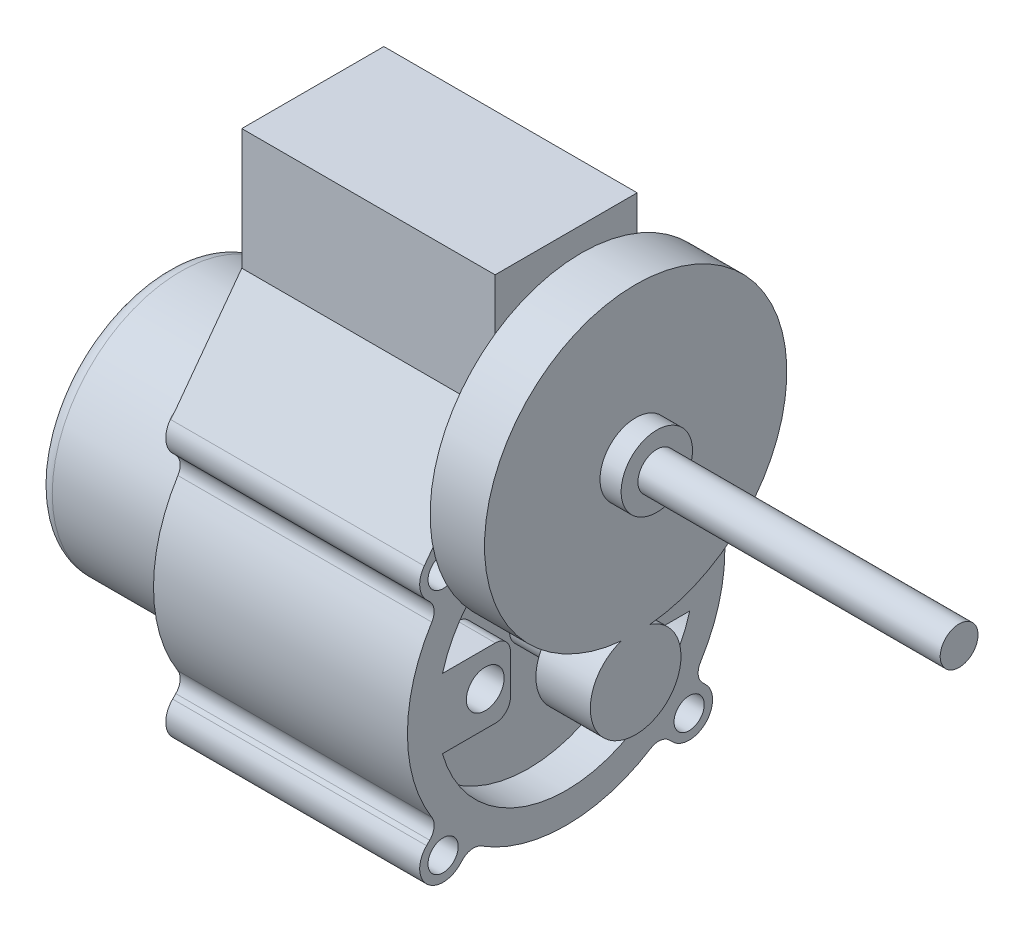
from build123d import *

# Parameters (mm, degrees)
SKETCH1_R                = 13.335
SKETCH1_R_2              = 10.795
BOSS_EXTRUDE1_DEPTH      = 21.336
SKETCH2_R                = 1.27
BOSS_EXTRUDE2_DEPTH      = 21.336
FILLET1_R                = 1.27
CIRPATTERN1_COUNT        = 4
FILLET1_OF_CIRPATTERN1_R = 1.27
SKETCH3_R                = 1.5875
BOSS_EXTRUDE3_DEPTH      = 3.175
FILLET2_R                = 1.27
SKETCH4_R                = 10.795
BOSS_EXTRUDE4_DEPTH      = 30.48
FILLET3_R                = 1.27
BOSS_EXTRUDE5_DEPTH      = 21.2852
SKETCH6_R                = 1.5875
BOSS_EXTRUDE6_DEPTH      = 6.985
SKETCH7_R                = 4.064
BOSS_EXTRUDE7_DEPTH      = 1.27
SKETCH8_R                = 12.7
SKETCH8_R_2              = 4.064
SKETCH8_R_3              = 3.81
BOSS_EXTRUDE10_DEPTH     = 4.572
SKETCH9_R                = 2.9972
BOSS_EXTRUDE12_DEPTH     = 1.778
SKETCH10_R               = 1.5875
BOSS_EXTRUDE13_DEPTH     = 25.4


with BuildPart() as part:
    # Sketch1 → Boss-Extrude1 (new body)
    with BuildSketch(Plane(origin=(0, 0, 0), x_dir=(0, 0, -1), z_dir=(1, 0, 0))):
        Circle(SKETCH1_R)
        Circle(SKETCH1_R_2, mode=Mode.SUBTRACT)
    extrude(amount=-BOSS_EXTRUDE1_DEPTH)

    # Sketch2 → Boss-Extrude2 (add)
    with BuildSketch(Plane(origin=(0, 0, 0), x_dir=(0, 0, -1), z_dir=(1, 0, 0))):
        with BuildLine():
            Line((8.944335097, -11.728214494), (7.934024936, -10.717904334))
            ThreePointArc((7.934024936, -10.717904334), (9.429268927, -9.429268927), (10.717904334, -7.934024936))
            Line((10.717904334, -7.934024936), (11.728214494, -8.944335097))
            ThreePointArc((11.728214494, -8.944335097), (11.728214494, -11.728214494), (8.944335097, -11.728214494))
        make_face()
        with Locations((10.336274795, -10.336274795)):
            Circle(SKETCH2_R, mode=Mode.SUBTRACT)
    boss_extrude2 = extrude(amount=-BOSS_EXTRUDE2_DEPTH)

    # Fillet1
    fillet1_edges = [part.edges().sort_by_distance(p)[0] for p in [
        (-10.668, -10.717904334, -7.934024936),
        (-10.668, -7.934024936, -10.717904334),
    ]]
    fillet(fillet1_edges, radius=FILLET1_R)

    # CirPattern1: Boss-Extrude2 ×4 about axis
    cirpattern1_axis = Axis((0, 0, 0), (1, 0, 0))
    for i in range(1, CIRPATTERN1_COUNT):
        add(boss_extrude2.rotate(cirpattern1_axis, i * 360 / CIRPATTERN1_COUNT))

    # Fillet1 of CirPattern1
    fillet1_of_cirpattern1_edges = [part.edges().sort_by_distance(p)[0] for p in [
        (-10.668, 7.934024936, -10.717904334),
        (-10.668, 10.717904334, -7.934024936),
        (-10.668, 10.717904334, 7.934024936),
        (-10.668, 7.934024936, 10.717904334),
        (-10.668, -7.934024936, 10.717904334),
        (-10.668, -10.717904334, 7.934024936),
    ]]
    fillet(fillet1_of_cirpattern1_edges, radius=FILLET1_OF_CIRPATTERN1_R)

    # Sketch3 → Boss-Extrude3 (add)
    # profile 1 of 2: a face of its own
    with BuildSketch(Plane(origin=(0, 0, 0), x_dir=(0, 0, -1), z_dir=(1, 0, 0))):
        with BuildLine():
            Line((-10.392294453, 2.921), (-4.677294453, 2.921))
            Line((-4.677294453, 2.921), (-4.677294453, -2.921))
            Line((-4.677294453, -2.921), (-10.392294453, -2.921))
            ThreePointArc((-10.392294453, -2.921), (-10.795, 0), (-10.392294453, 2.921))
        make_face()
        with Locations((-6.7945, 0)):
            Circle(SKETCH3_R, mode=Mode.SUBTRACT)
    # profile 2 of 2: a face of its own
    with BuildSketch(Plane(origin=(0, 0, 0), x_dir=(0, 0, -1), z_dir=(1, 0, 0))):
        with BuildLine():
            Line((10.392294453, 2.921), (4.677294453, 2.921))
            Line((4.677294453, 2.921), (4.677294453, -2.921))
            Line((4.677294453, -2.921), (10.392294453, -2.921))
            ThreePointArc((10.392294453, -2.921), (10.795, 0), (10.392294453, 2.921))
        make_face()
        with Locations((6.7945, 0)):
            Circle(SKETCH3_R, mode=Mode.SUBTRACT)
    extrude(amount=-BOSS_EXTRUDE3_DEPTH)

    # Fillet2
    fillet2_edges = [part.edges().sort_by_distance(p)[0] for p in [
        (-1.5875, -2.921, -4.677294453),
        (-1.5875, 2.921, -4.677294453),
        (-1.5875, 2.921, 4.677294453),
        (-1.5875, -2.921, 4.677294453),
    ]]
    fillet(fillet2_edges, radius=FILLET2_R)

    # Sketch4 → Boss-Extrude4 (add)
    with BuildSketch(Plane.ZY.offset(3.175)):
        with Locations(Location((0, 0, 0), (0, 0, 180))):
            Circle(SKETCH4_R)
    extrude(amount=BOSS_EXTRUDE4_DEPTH)

    # Fillet3
    fillet3_edges = [part.edges().sort_by_distance(p)[0] for p in [
        (-33.655, 0, 10.795),
    ]]
    fillet(fillet3_edges, radius=FILLET3_R)

    # Sketch5 → Boss-Extrude5 (add)
    with BuildSketch(Plane(origin=(0, 0, 0), x_dir=(0, 0, -1), z_dir=(1, 0, 0))):
        with BuildLine():
            Line((-11.919383507, 11.506214561), (-5.969, 19.558))
            Line((-5.969, 19.558), (-5.969, 29.718))
            Line((-5.969, 29.718), (5.969, 29.718))
            Line((5.969, 29.718), (5.969, 19.558))
            Line((5.969, 19.558), (11.919383507, 11.506214561))
            ThreePointArc((11.919383507, 11.506214561), (10.482758209, 12.299317041), (8.944335097, 11.728214494))
            Line((8.944335097, 11.728214494), (8.678267418, 11.462146816))
            ThreePointArc((8.678267418, 11.462146816), (7.921930715, 11.098101014), (7.10369904, 11.285374825))
            ThreePointArc((7.10369904, 11.285374825), (0, 13.335), (-7.10369904, 11.285374825))
            ThreePointArc((-7.10369904, 11.285374825), (-7.921930715, 11.098101014), (-8.678267418, 11.462146816))
            Line((-8.678267418, 11.462146816), (-8.944335097, 11.728214494))
            ThreePointArc((-8.944335097, 11.728214494), (-10.482758209, 12.299317041), (-11.919383507, 11.506214561))
        make_face()
    extrude(amount=-BOSS_EXTRUDE5_DEPTH)

    # Sketch6 → Boss-Extrude6 (add)
    with BuildSketch(Plane(origin=(-3.175, 0, 0), x_dir=(0, 0, -1), z_dir=(1, 0, 0))):
        with Locations(Location((0, 0, 0), (0, 0, 180))):
            Circle(SKETCH6_R)
    extrude(amount=BOSS_EXTRUDE6_DEPTH)

    # Sketch7 → Boss-Extrude7 (add)
    with BuildSketch(Plane(origin=(0, 0, 0), x_dir=(0, 0, -1), z_dir=(1, 0, 0))):
        with Locations((0, 16.256)):
            Circle(SKETCH7_R)
    extrude(amount=BOSS_EXTRUDE7_DEPTH)

    # Sketch8 → Boss-Extrude10 (add)
    # profile 1 of 3: a face of its own
    with BuildSketch(Plane(origin=(1.27, 0, 0), x_dir=(0, 0, -1), z_dir=(1, 0, 0))):
        with Locations((0, 16.256)):
            Circle(SKETCH8_R)
        with Locations((0, 16.256)):
            Circle(SKETCH8_R_2, mode=Mode.SUBTRACT)
    # profile 2 of 3: a face of its own
    with BuildSketch(Plane(origin=(1.27, 0, 0), x_dir=(0, 0, -1), z_dir=(1, 0, 0))):
        with Locations((0, 16.256)):
            Circle(SKETCH8_R_2)
    # profile 3 of 3: a face of its own
    with BuildSketch(Plane(origin=(1.27, 0, 0), x_dir=(0, 0, -1), z_dir=(1, 0, 0))):
        Circle(SKETCH8_R_3)
    extrude(amount=BOSS_EXTRUDE10_DEPTH)

    # Sketch9 → Boss-Extrude12 (add)
    with BuildSketch(Plane(origin=(5.842, 0, 0), x_dir=(0, 0, -1), z_dir=(1, 0, 0))):
        with Locations((0, 16.256)):
            Circle(SKETCH9_R)
    extrude(amount=BOSS_EXTRUDE12_DEPTH)

    # Sketch10 → Boss-Extrude13 (add)
    with BuildSketch(Plane(origin=(7.62, 0, 0), x_dir=(0, 0, -1), z_dir=(1, 0, 0))):
        with Locations((0, 16.256)):
            Circle(SKETCH10_R)
    extrude(amount=BOSS_EXTRUDE13_DEPTH)


solid = part.part
